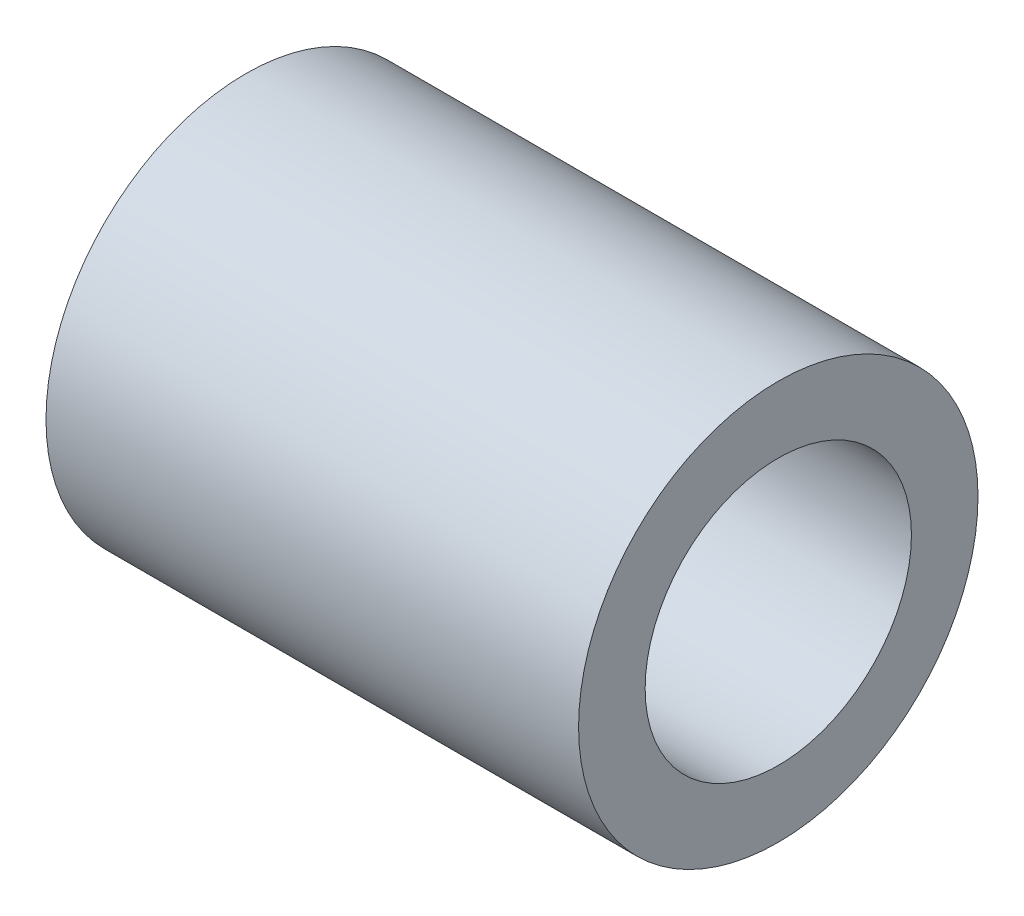
from build123d import *

# Parameters (mm, degrees)
SKETCH1_R           = 30
SKETCH1_R_2         = 20
BOSS_EXTRUDE1_DEPTH = 40


with BuildPart() as part:
    # Sketch1 → Boss-Extrude1 (new, symmetric)
    with BuildSketch(Plane(origin=(0, 0, 0), x_dir=(0, 0, -1), z_dir=(1, 0, 0))):
        Circle(SKETCH1_R)
        Circle(SKETCH1_R_2, mode=Mode.SUBTRACT)
    extrude(amount=BOSS_EXTRUDE1_DEPTH, both=True)


solid = part.part
